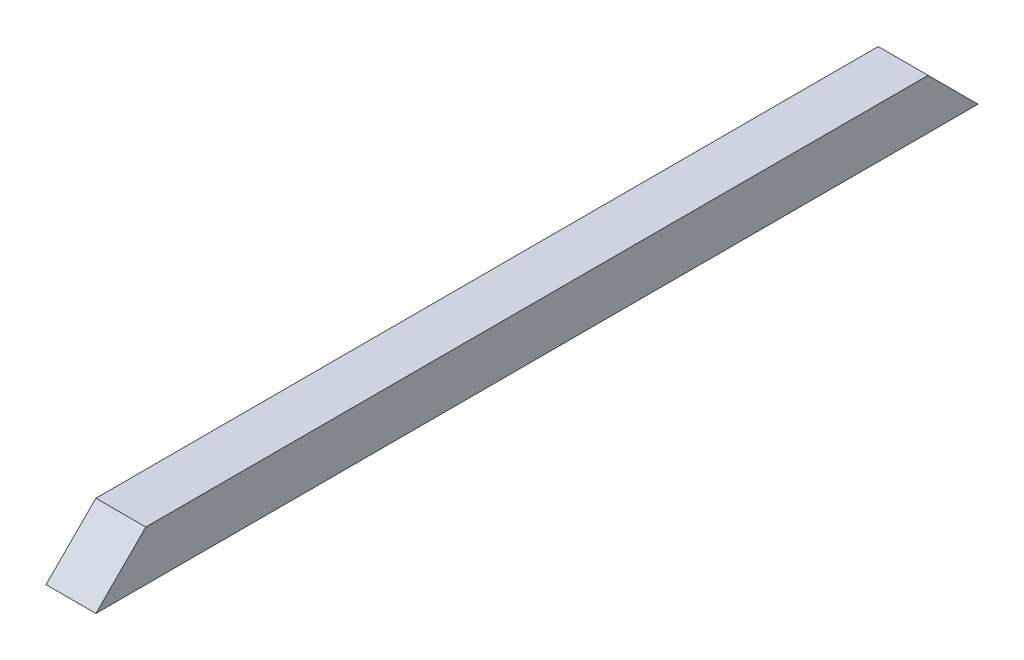
from build123d import *

# Parameters (mm, degrees)
SKETCH1_W               = 20
SKETCH1_H               = 20
BOSS_EXTRUDE1_DEPTH     = 600
CUT_EXTRUDE1_DEPTH      = 601.666296707
CUT_EXTRUDE1_DEPTH_BACK = 601.666296707


with BuildPart() as part:
    # Sketch1 → Boss-Extrude1 (new body)
    with BuildSketch(Plane.XY):
        with Locations((10, -10)):
            Rectangle(SKETCH1_W, SKETCH1_H)
    extrude(amount=BOSS_EXTRUDE1_DEPTH)

    # Sketch2 → Cut-Extrude1 (cut, two sides: drawn at the far end of the back side and taken through both)
    with BuildSketch(Plane(origin=(20, 0, 0), x_dir=(0, 0, -1), z_dir=(1, 0, 0)).offset(-CUT_EXTRUDE1_DEPTH_BACK)):
        Polygon((-600, -20), (-600, 0), (-580, 0), align=None)
        Polygon((-266.437273607, 0), (-246.446609407, -20), (0, -20), (0, 0), align=None)
    extrude(amount=CUT_EXTRUDE1_DEPTH + CUT_EXTRUDE1_DEPTH_BACK, mode=Mode.SUBTRACT)


solid = part.part
